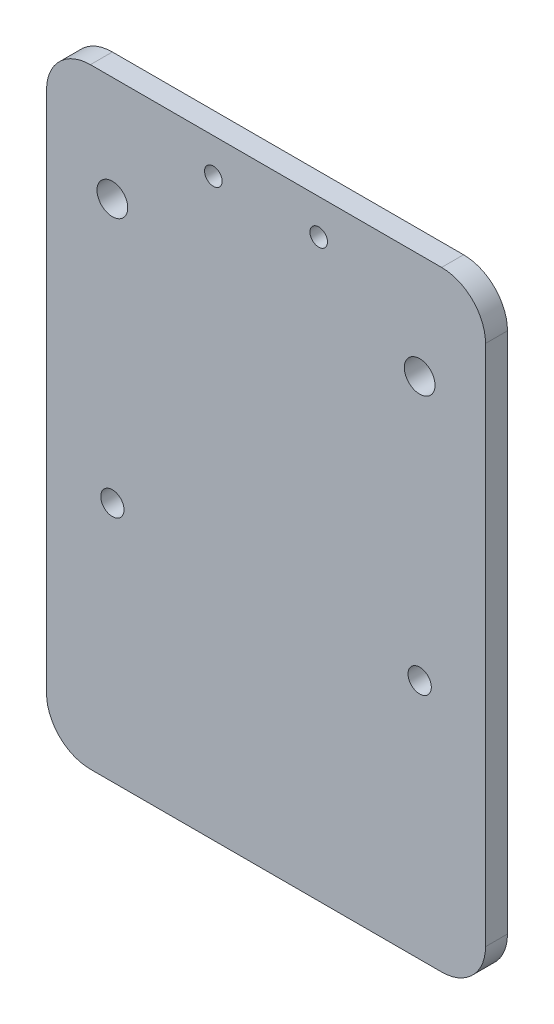
from build123d import *

# Parameters (mm, degrees)
CROQUIS1_W              = 100
CROQUIS1_H              = 139
CROQUIS1_R              = 2.65
CROQUIS1_R_2            = 3.5
CROQUIS1_R_3            = 2
SALIENTE_EXTRUIR1_DEPTH = 5
REDONDEO3_R             = 10


with BuildPart() as part:
    # Croquis1 → Saliente-Extruir1 (new body)
    with BuildSketch(Plane.XY):
        with Locations((50, 69.5)):
            Rectangle(CROQUIS1_W, CROQUIS1_H)
        with Locations((15, 55)):
            Circle(CROQUIS1_R, mode=Mode.SUBTRACT)
        with Locations((85, 55)):
            Circle(CROQUIS1_R, mode=Mode.SUBTRACT)
        with Locations((15, 115)):
            Circle(CROQUIS1_R_2, mode=Mode.SUBTRACT)
        with Locations((38, 131)):
            Circle(CROQUIS1_R_3, mode=Mode.SUBTRACT)
        with Locations((62, 131)):
            Circle(CROQUIS1_R_3, mode=Mode.SUBTRACT)
        with Locations((85, 115)):
            Circle(CROQUIS1_R_2, mode=Mode.SUBTRACT)
    extrude(amount=SALIENTE_EXTRUIR1_DEPTH)

    # Redondeo3
    redondeo3_edges = [part.edges().sort_by_distance(p)[0] for p in [
        (0, 0, 2.5),
        (100, 0, 2.5),
        (100, 139, 2.5),
        (0, 139, 2.5),
    ]]
    fillet(redondeo3_edges, radius=REDONDEO3_R)


solid = part.part
